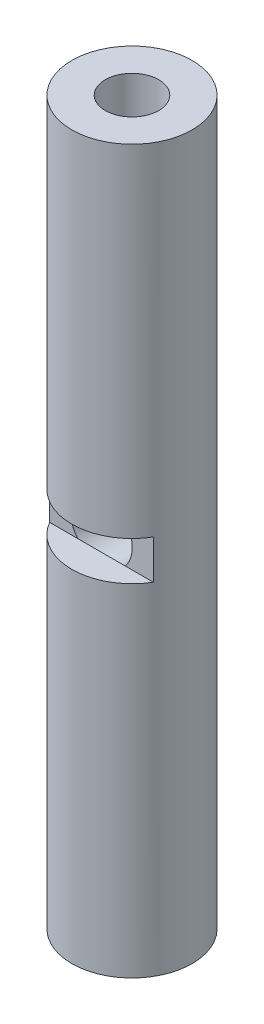
from build123d import *

# Parameters (mm, degrees)
SKETCH1_R                 = 2
BOSS_EXTRUDE1_DEPTH       = 12
SKETCH2_R                 = 1.025
CUT_EXTRUDE1_DEPTH        = 15.24
SKETCH3_W                 = 4
SKETCH3_H                 = 1.3
CUT_EXTRUDE2_DEPTH        = 15.24
F_2_56_TAPPED_HOLE1_D     = 1.778
F_2_56_TAPPED_HOLE1_DEPTH = 8.98398
F_2_56_TAPPED_HOLE1_TIP   = 0.53416509
F_2_56_TAPPED_HOLE2_D     = 1.778
F_2_56_TAPPED_HOLE2_DEPTH = 8.89
F_2_56_TAPPED_HOLE2_TIP   = 0.53416509


with BuildPart() as part:
    # Sketch1 → Boss-Extrude1 (new, symmetric)
    with BuildSketch(Plane(origin=(0, 0, 0), x_dir=(1, 0, 0), z_dir=(0, 1, 0))):
        with Locations(Location((0, 0, 0), (0, 0, 270))):
            Circle(SKETCH1_R)
    extrude(amount=BOSS_EXTRUDE1_DEPTH, both=True)

    # Sketch2 → Cut-Extrude1 (cut)
    with BuildSketch(Plane.XY.offset(1.016)):
        Circle(SKETCH2_R)
    extrude(amount=-CUT_EXTRUDE1_DEPTH, mode=Mode.SUBTRACT)

    # Sketch3 → Cut-Extrude2 (cut)
    with BuildSketch(Plane(origin=(0, 0, 1.016), x_dir=(-1, 0, 0), z_dir=(0, 0, -1))):
        Rectangle(SKETCH3_W, SKETCH3_H)
    extrude(amount=-CUT_EXTRUDE2_DEPTH, mode=Mode.SUBTRACT)

    # #2-56 Tapped Hole1
    with Locations(Plane(origin=(0, 12, 0), x_dir=(1, 0, 0), z_dir=(0, 1, 0))):
        with Locations((0, 0)):
            Hole(F_2_56_TAPPED_HOLE1_D / 2, depth=F_2_56_TAPPED_HOLE1_DEPTH)
            with Locations((0, 0, -(F_2_56_TAPPED_HOLE1_DEPTH + F_2_56_TAPPED_HOLE1_TIP / 2))):  # 118° drill point
                Cone(0, F_2_56_TAPPED_HOLE1_D / 2, F_2_56_TAPPED_HOLE1_TIP, mode=Mode.SUBTRACT)

    # #2-56 Tapped Hole2
    with Locations(Plane(origin=(0, -12, 0), x_dir=(-1, 0, 0), z_dir=(0, -1, 0))):
        with Locations((0, 0)):
            Hole(F_2_56_TAPPED_HOLE2_D / 2, depth=F_2_56_TAPPED_HOLE2_DEPTH)
            with Locations((0, 0, -(F_2_56_TAPPED_HOLE2_DEPTH + F_2_56_TAPPED_HOLE2_TIP / 2))):  # 118° drill point
                Cone(0, F_2_56_TAPPED_HOLE2_D / 2, F_2_56_TAPPED_HOLE2_TIP, mode=Mode.SUBTRACT)


solid = part.part
